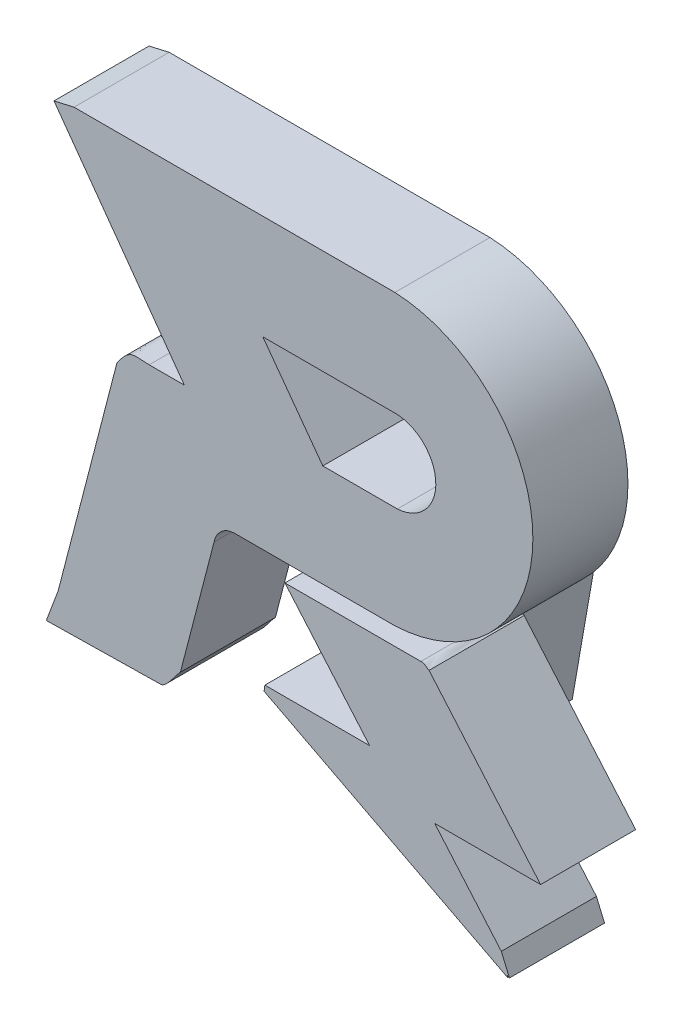
from build123d import *

# Parameters (mm, degrees)
EXTRUDE_1_DEPTH   = 5
EXTRUDE_1_2_DEPTH = 5
SCALE_3_SCALE     = 2
SCALE_4_SCALE     = 1.2
EXTRUDE_2_DEPTH   = 10


with BuildPart() as part:
    # 草图1 → 凸台-拉伸1 (new body)
    with BuildSketch(Plane.XY):
        with BuildLine():
            Line((0, 0), (6, 0.101807226))
            add(Edge.make_bspline(
                [(6, 0.101807226), (6.11703333, 0.103793032), (6.539331141, 0.445382193), (6.766853053, 0.870706022), (7.048380288, 1.166208583)],
                knots=[0, 0, 0, 0, 0.218980936, 1, 1, 1, 1], degree=3))
            Line((7.048380288, 1.166208583), (8.821569818, 7.983706688))
            add(Edge.make_bspline(
                [(8.821569818, 7.983706688), (8.880494845, 8.292718266), (9.133200384, 8.684107586), (9.674656455, 8.919540561), (9.945425552, 8.922373879), (10.105270187, 8.922373879)],
                knots=[0, 0, 0, 0, 0.545722685, 0.722751064, 1, 1, 1, 1], degree=3))
            Line((10.105270187, 8.922373879), (18.328135523, 8.922373879))
            ThreePointArc((18.328135523, 8.922373879), (25.585377637, 16.513323181), (18.328135523, 24.104272483))
            Line((18.328135523, 24.104272483), (1.457415265, 24.104272483))
            Line((1.457415265, 24.104272483), (0.402798811, 23.863217293))
            Line((0.402798811, 23.863217293), (7.257301052, 14.347574118))
            Line((7.257301052, 14.347574118), (5.407878695, 14.347574118))
            add(Edge.make_bspline(
                [(3.713540643, 13.590672305), (3.874120401, 13.814225479), (4.381582253, 14.534719233), (4.957975747, 14.347574118), (5.407878695, 14.347574118)],
                knots=[0, 0, 0, 0, 0.493224749, 1, 1, 1, 1], degree=3))
            Line((3.713540643, 13.590672305), (0.620905315, 1.652820835))
            Line((0.620905315, 1.652820835), (0, 0))
        make_face()
        with BuildLine():
            Line((11.385415133, 18.611449111), (14.539491637, 14.308084749))
            Line((14.539491637, 14.308084749), (18.458814961, 14.308084749))
            ThreePointArc((18.458814961, 14.308084749), (20.480809555, 16.52315261), (18.328135523, 18.611449111))
            Line((18.328135523, 18.611449111), (11.385415133, 18.611449111))
        make_face(mode=Mode.SUBTRACT)
    extrude(amount=EXTRUDE_1_DEPTH)


with BuildPart() as body_2:
    # 草图1 → Extrude 1 2 (new body)
    with BuildSketch(Plane.XY):
        with BuildLine():
            Line((12.54595398, 7.983706688), (17.000047973, 2.802413675))
            Line((17.000047973, 2.802413675), (11.581733222, 2.802413675))
            Line((11.581733222, 2.802413675), (11.492362709, 2.802413675))
            Line((11.492362709, 2.802413675), (11.450048683, 2.502081107))
            Line((11.450048683, 2.502081107), (24.259462505, -4.134416043))
            Line((24.259462505, -4.134416043), (24.229199468, -4.039081478))
            Line((24.229199468, -4.039081478), (24.354797069, -4.104153006))
            Line((24.354797069, -4.104153006), (23.925862862, -3.103289873))
            Line((23.925862862, -3.103289873), (20.421472701, 0.970915565))
            Line((20.421472701, 0.970915565), (25.991187435, 0.970915565))
            Line((25.991187435, 0.970915565), (20.124897042, 7.79106718))
            add(Edge.make_bspline(
                [(19.697641325, 7.983706688), (19.882658594, 8.02773802), (19.976864064, 7.850257316), (20.124897042, 7.79106718)],
                knots=[0, 0, 0, 0, 1, 1, 1, 1], degree=3))
            Line((19.697641325, 7.983706688), (12.54595398, 7.983706688))
        make_face()
    extrude(amount=EXTRUDE_1_2_DEPTH)


with BuildPart() as body_2_1:
    # 缩放比例3: scaled about (0, 0, 0)
    add(body_2.part.scale(SCALE_3_SCALE))


with BuildPart() as part_1:
    # 缩放比例3: scaled about (0, 0, 0)
    add(part.part.scale(SCALE_3_SCALE))


with BuildPart() as body_2_2:
    # 缩放比例4: scaled about (0, 0, 0)
    add(body_2_1.part.scale(SCALE_4_SCALE))


with BuildPart() as part_2:
    # 缩放比例4: scaled about (0, 0, 0)
    add(part_1.part.scale(SCALE_4_SCALE))


    add(body_2_2.part)  # 凸台-拉伸2 merges body 2
    # 草图2 → 凸台-拉伸2 (add)
    with BuildSketch(Plane(origin=(0, 0, 0), x_dir=(-1, 0, 0), z_dir=(0, 0, -1))):
        Polygon((-30.110289552, 19.160896051), (-44.376642336, 2.565342813), (-47.27433918, 19.160896051), align=None)
        Polygon((-40.066068009, 21.41369731), (-24.252648448, 21.41369731), (-17.417522526, 34.434177884), (-34.89477993, 34.339403398), align=None)
    extrude(amount=EXTRUDE_2_DEPTH)

    # 草图3 → 切除-放样1 section 0
    with BuildSketch(Plane(origin=(27.82574414, 14.607177054, 0), x_dir=(0, 0, 1), z_dir=(-0.8854154326833944, -0.4648005072782058, 0))):
        with BuildLine():
            Line((-10, 20.695761788), (0, 22.392879205))
            Line((0, 22.392879205), (-10, 22.392879205))
            Line((-10, 22.392879205), (-10, 20.695761788))
        make_face()
    # 草图4 → 切除-放样1 section 1
    with BuildSketch(Plane(origin=(41.92293393, 16.772435253, 0), x_dir=(0, 0, -1), z_dir=(0.9284517800893264, 0.3714529472880265, 0))):
        with BuildLine():
            Line((10, 17.404338088), (0, 18.920711362))
            Line((0, 18.920711362), (10, 18.920711362))
            Line((10, 18.920711362), (10, 17.404338088))
        make_face()
    loft(mode=Mode.SUBTRACT)


solid = part_2.part
